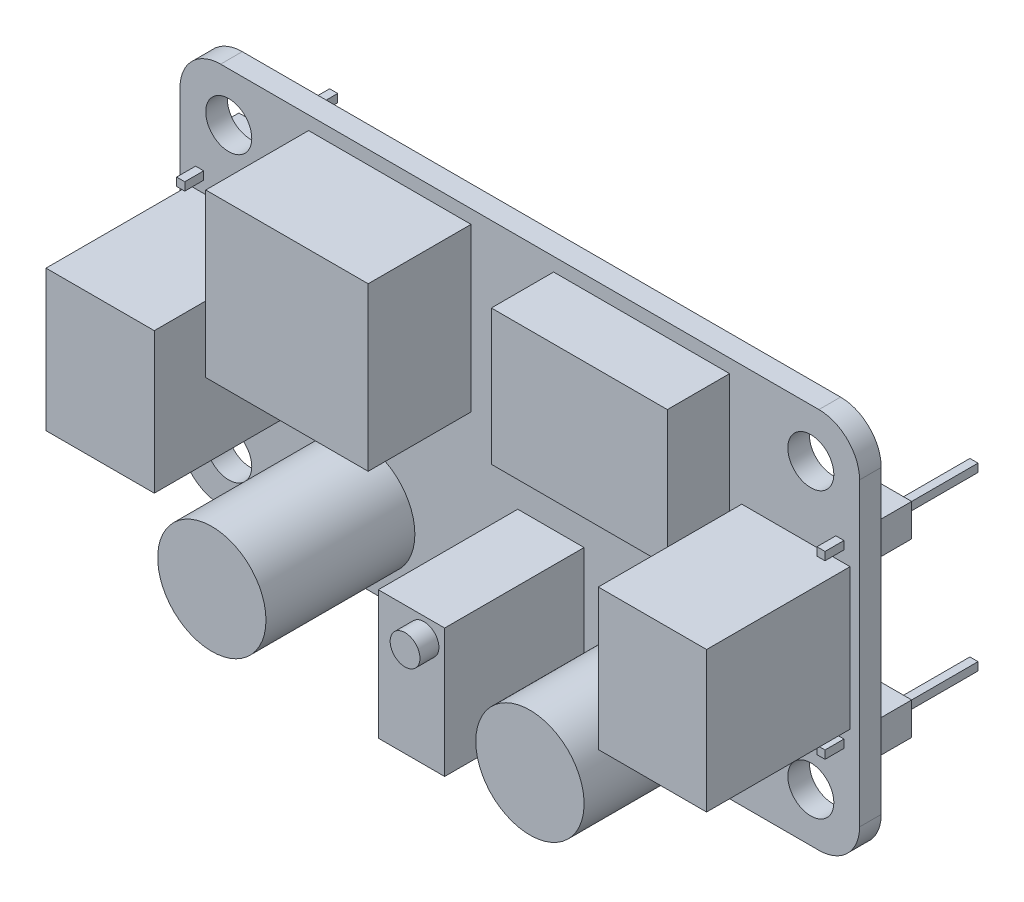
from build123d import *

# Parameters (mm, degrees)
ESQUISSE1_W               = 50.2
ESQUISSE1_H               = 28.2
BOSS_EXTRU_1_DEPTH        = 1.6
D_GAGEMENT_M31_D          = 3.4
CONG_1_R                  = 3
ESQUISSE5_W               = 8
ESQUISSE5_H               = 10.4
BOSS_EXTRU_2_DEPTH        = 10.6
ESQUISSE6_R               = 4
BOSS_EXTRU_3_DEPTH        = 11
BOSS_EXTRU_3_2_DEPTH      = 11
ESQUISSE7_W               = 4.9
ESQUISSE7_H               = 9.5
BOSS_EXTRU_4_DEPTH        = 10.3
ESQUISSE8_R               = 1.1
BOSS_EXTRU_5_DEPTH        = 1.4
ESQUISSE9_W               = 12
ESQUISSE9_H               = 12
BOSS_EXTRU_6_DEPTH        = 7.6
ESQUISSE10_W              = 13
ESQUISSE10_H              = 10
BOSS_EXTRU_7_DEPTH        = 4.6
BOSS_EXTRU_8_DEPTH        = 8.3
BOSS_EXTRU_8_DEPTH_BACK   = 3
ESQUISSE11_W              = 0.6
ESQUISSE11_H              = 0.6
BOSS_EXTRU_8_2_DEPTH      = 8.3
BOSS_EXTRU_8_2_DEPTH_BACK = 3
BOSS_EXTRU_8_3_DEPTH      = 8.3
BOSS_EXTRU_8_3_DEPTH_BACK = 3
BOSS_EXTRU_8_4_DEPTH      = 8.3
BOSS_EXTRU_8_4_DEPTH_BACK = 3
ESQUISSE12_W              = 2.4
ESQUISSE12_H              = 2.4
BOSS_EXTRU_9_DEPTH        = 2.5
BOSS_EXTRU_9_2_DEPTH      = 2.5
BOSS_EXTRU_9_3_DEPTH      = 2.5
BOSS_EXTRU_9_4_DEPTH      = 2.5


with BuildPart() as part:
    # Esquisse1 → Boss.-Extru.1 (new body)
    with BuildSketch(Plane.XY):
        Rectangle(ESQUISSE1_W, ESQUISSE1_H)
    extrude(amount=BOSS_EXTRU_1_DEPTH)

    # Dégagement M31 (through all)
    with Locations(Plane.XY.offset(1.6)):
        with Locations((-21.5, 10.5), (21.5, 10.5), (21.5, -10.5), (-21.5, -10.5)):
            Hole(D_GAGEMENT_M31_D / 2)

    # Congé1
    cong_1_edges = [part.edges().sort_by_distance(p)[0] for p in [
        (-25.1, 14.1, 0.8),
        (25.1, 14.1, 0.8),
        (25.1, -14.1, 0.8),
        (-25.1, -14.1, 0.8),
    ]]
    fillet(cong_1_edges, radius=CONG_1_R)

    # Esquisse5 → Boss.-Extru.2 (add)
    with BuildSketch(Plane.XY.offset(1.6)):
        with Locations((-20.4, 0)):
            Rectangle(ESQUISSE5_W, ESQUISSE5_H)
        with Locations((20.4, 0)):
            Rectangle(ESQUISSE5_W, ESQUISSE5_H)
    extrude(amount=BOSS_EXTRU_2_DEPTH)



with BuildPart() as body_2:
    # Esquisse6 → Boss.-Extru.3 (new body)
    with BuildSketch(Plane.XY.offset(1.6)):
        with Locations((-11.75, -8.8)):
            Circle(ESQUISSE6_R)
    extrude(amount=BOSS_EXTRU_3_DEPTH)


with BuildPart() as body_3:
    # Esquisse6 → Boss.-Extru.3 2 (new body)
    with BuildSketch(Plane.XY.offset(1.6)):
        with Locations(Location((11.75, -8.8, 0), (0, 0, 180))):
            Circle(ESQUISSE6_R)
    extrude(amount=BOSS_EXTRU_3_2_DEPTH)


with BuildPart() as body_4:
    # Esquisse7 → Boss.-Extru.4 (new body)
    with BuildSketch(Plane.XY.offset(1.6)):
        with Locations((2.3, -8.15)):
            Rectangle(ESQUISSE7_W, ESQUISSE7_H)
    extrude(amount=BOSS_EXTRU_4_DEPTH)


with BuildPart() as part_1:
    add(part.part)

    add(body_4.part)  # Boss.-Extru.5 merges body 4
    # Esquisse8 → Boss.-Extru.5 (add)
    with BuildSketch(Plane.XY.offset(11.9)):
        with Locations((3.223425578, -4.855392367)):
            Circle(ESQUISSE8_R)
    extrude(amount=BOSS_EXTRU_5_DEPTH)


with BuildPart() as body_4_2:
    # Esquisse9 → Boss.-Extru.6 (new body)
    with BuildSketch(Plane.XY.offset(1.6)):
        with Locations((-9.6, 7.1)):
            Rectangle(ESQUISSE9_W, ESQUISSE9_H)
    extrude(amount=BOSS_EXTRU_6_DEPTH)


with BuildPart() as body_5:
    # Esquisse10 → Boss.-Extru.7 (new body)
    with BuildSketch(Plane.XY.offset(1.6)):
        with Locations((9, 8.1)):
            Rectangle(ESQUISSE10_W, ESQUISSE10_H)
    extrude(amount=BOSS_EXTRU_7_DEPTH)


with BuildPart() as body_6:
    # Esquisse11 → Boss.-Extru.8 (new, two sides: drawn at the far end of the back side and taken through both)
    with BuildSketch(Plane(origin=(0, 0, 0), x_dir=(-1, 0, 0), z_dir=(0, 0, -1)).offset(-BOSS_EXTRU_8_DEPTH_BACK)):
        with Locations((-23.65, 6.35)):
            Rectangle(ESQUISSE11_W, ESQUISSE11_H)
    extrude(amount=BOSS_EXTRU_8_DEPTH + BOSS_EXTRU_8_DEPTH_BACK)


with BuildPart() as body_7:
    # Esquisse11 → Boss.-Extru.8 2 (new, two sides: drawn at the far end of the back side and taken through both)
    with BuildSketch(Plane(origin=(0, 0, 0), x_dir=(-1, 0, 0), z_dir=(0, 0, -1)).offset(-BOSS_EXTRU_8_2_DEPTH_BACK)):
        with Locations((23.65, 6.35)):
            Rectangle(ESQUISSE11_W, ESQUISSE11_H)
    extrude(amount=BOSS_EXTRU_8_2_DEPTH + BOSS_EXTRU_8_2_DEPTH_BACK)


with BuildPart() as body_8:
    # Esquisse11 → Boss.-Extru.8 3 (new, two sides: drawn at the far end of the back side and taken through both)
    with BuildSketch(Plane(origin=(0, 0, 0), x_dir=(-1, 0, 0), z_dir=(0, 0, -1)).offset(-BOSS_EXTRU_8_3_DEPTH_BACK)):
        with Locations((-23.65, -6.35)):
            Rectangle(ESQUISSE11_W, ESQUISSE11_H)
    extrude(amount=BOSS_EXTRU_8_3_DEPTH + BOSS_EXTRU_8_3_DEPTH_BACK)


with BuildPart() as body_9:
    # Esquisse11 → Boss.-Extru.8 4 (new, two sides: drawn at the far end of the back side and taken through both)
    with BuildSketch(Plane(origin=(0, 0, 0), x_dir=(-1, 0, 0), z_dir=(0, 0, -1)).offset(-BOSS_EXTRU_8_4_DEPTH_BACK)):
        with Locations((23.65, -6.35)):
            Rectangle(ESQUISSE11_W, ESQUISSE11_H)
    extrude(amount=BOSS_EXTRU_8_4_DEPTH + BOSS_EXTRU_8_4_DEPTH_BACK)


with BuildPart() as body_10:
    # Esquisse12 → Boss.-Extru.9 (new body)
    with BuildSketch(Plane(origin=(0, 0, 0), x_dir=(-1, 0, 0), z_dir=(0, 0, -1))):
        with Locations((-23.65, 6.35)):
            Rectangle(ESQUISSE12_W, ESQUISSE12_H)
    extrude(amount=BOSS_EXTRU_9_DEPTH)


with BuildPart() as body_11:
    # Esquisse12 → Boss.-Extru.9 2 (new body)
    with BuildSketch(Plane(origin=(0, 0, 0), x_dir=(-1, 0, 0), z_dir=(0, 0, -1))):
        with Locations((23.65, 6.35)):
            Rectangle(ESQUISSE12_W, ESQUISSE12_H)
    extrude(amount=BOSS_EXTRU_9_2_DEPTH)


with BuildPart() as body_12:
    # Esquisse12 → Boss.-Extru.9 3 (new body)
    with BuildSketch(Plane(origin=(0, 0, 0), x_dir=(-1, 0, 0), z_dir=(0, 0, -1))):
        with Locations((23.65, -6.35)):
            Rectangle(ESQUISSE12_W, ESQUISSE12_H)
    extrude(amount=BOSS_EXTRU_9_3_DEPTH)


with BuildPart() as body_13:
    # Esquisse12 → Boss.-Extru.9 4 (new body)
    with BuildSketch(Plane(origin=(0, 0, 0), x_dir=(-1, 0, 0), z_dir=(0, 0, -1))):
        with Locations((-23.65, -6.35)):
            Rectangle(ESQUISSE12_W, ESQUISSE12_H)
    extrude(amount=BOSS_EXTRU_9_4_DEPTH)


solid = Compound([body_2.part, body_3.part, part_1.part, body_4_2.part, body_5.part, body_6.part, body_7.part, body_8.part, body_9.part, body_10.part, body_11.part, body_12.part, body_13.part])
